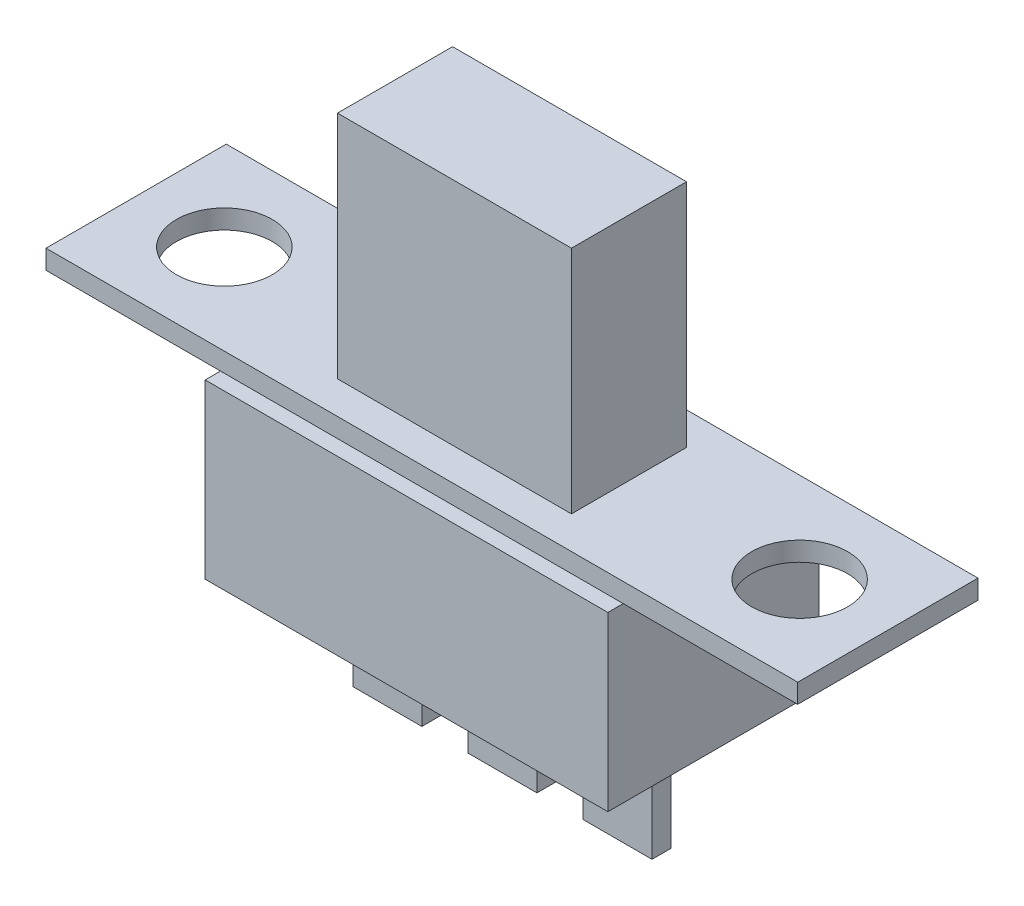
from build123d import *

# Parameters (mm, degrees)
SKETCH_1_W           = 9.8
SKETCH_1_H           = 4.7
SKETCH_1_R           = 1.25
EXTRUDE_1_DEPTH      = 0.5
SKETCH_2_W           = 5.25
SKETCH_2_H           = 5.5
EXTRUDE_2_DEPTH      = 4.5
EXTRUDE_3_DEPTH      = 0.25
EXTRUDE_3_DEPTH_BACK = 0.25
SKETCH_3_W           = 1.8
SKETCH_3_H           = 3
SKETCH_3_W_2         = 0.9
SKETCH_4_W           = 6.1
SKETCH_4_H           = 3
EXTRUDE_4_DEPTH      = 6


with BuildPart() as part:
    # 草图1 → 凸台-拉伸1 (new body)
    with BuildSketch(Plane(origin=(0, 0, 0), x_dir=(1, 0, 0), z_dir=(0, 1, 0))):
        with Locations((4.9, 0)):
            Rectangle(SKETCH_1_W, SKETCH_1_H)
        with Locations(Location((7.5, 0, 0), (0, 0, 270))):
            Circle(SKETCH_1_R, mode=Mode.SUBTRACT)
    extrude(amount=EXTRUDE_1_DEPTH)

    # 草图2 → 凸台-拉伸2 (add)
    with BuildSketch(Plane.XZ):
        with Locations((2.625, 0)):
            Rectangle(SKETCH_2_W, SKETCH_2_H)
    extrude(amount=EXTRUDE_2_DEPTH)

    # 草图3 → 凸台-拉伸3 (add, two sides: drawn at the far end of the back side and taken through both)
    with BuildSketch(Plane.XY.offset(-EXTRUDE_3_DEPTH_BACK)):
        with Locations((3, -6)):
            Rectangle(SKETCH_3_W, SKETCH_3_H)
        with Locations((0.45, -6)):
            Rectangle(SKETCH_3_W_2, SKETCH_3_H)
    extrude(amount=EXTRUDE_3_DEPTH + EXTRUDE_3_DEPTH_BACK)

    # 镜向1: part across plane


with BuildPart() as part_1:
    add(part.part)
    add(part.part.mirror(Plane(origin=(0, 0.5, -2.35), x_dir=(0, 0, 1), z_dir=(1, 0, 0))))

    # 草图4 → 凸台-拉伸4 (add)
    with BuildSketch(Plane(origin=(0, 0.5, 0), x_dir=(1, 0, 0), z_dir=(0, 1, 0))):
        Rectangle(SKETCH_4_W, SKETCH_4_H)
    extrude(amount=EXTRUDE_4_DEPTH)


solid = part_1.part
